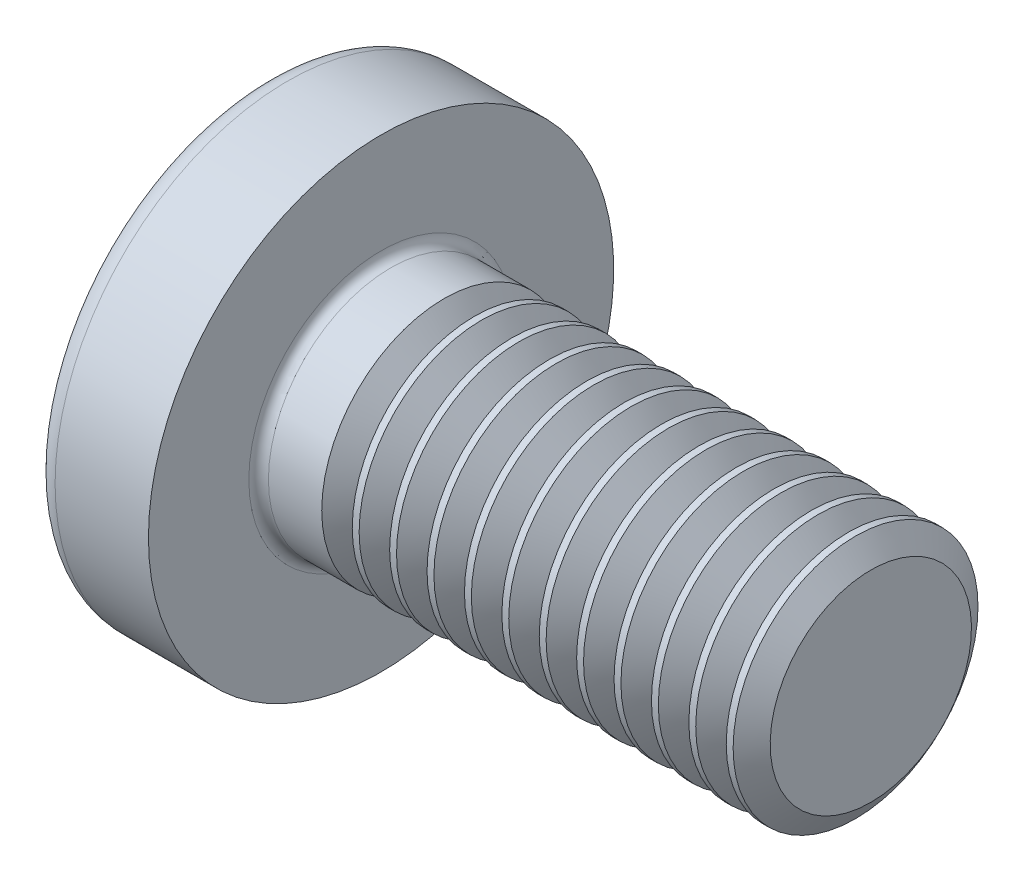
from build123d import *

# Parameters (mm, degrees)
FILLET1_R       = 0.2
RECPAT_COUNT    = 2
RECPAT_ANGLE    = 90
THDSCHPAT_COUNT = 12
THDSCHPAT_PITCH = 0.763636364


with BuildPart() as part:
    # BodySke → Base-Revolve (revolve)
    with BuildSketch(Plane.XY, mode=Mode.PRIVATE) as base_revolve_sk:
        with BuildLine():
            Line((3.7, 2.5), (3.7, 4.75))
            Line((3.7, 4.75), (1.79415598, 4.75))
            ThreePointArc((1.79415598, 4.75), (1.58538712, 4.698642149), (1.424271237, 4.556291391))
            ThreePointArc((1.424271237, 4.556291391), (0.364365445, 2.386856709), (0, 0))
            Line((0, 0), (13.7, 0))
            Line((13.7, 0), (13.7, 2.5))
            Line((13.7, 2.5), (3.7, 2.5))
        make_face()
    revolve(base_revolve_sk.sketch.rotate(Axis((1.79415598, 0, 0), (1, 0, 0)), 90), axis=Axis((1.79415598, 0, 0), (1, 0, 0)))

    # Fillet1
    fillet1_edges = [part.edges().sort_by_distance(p)[0] for p in [
        (3.7, 0, -2.5),
    ]]
    fillet(fillet1_edges, radius=FILLET1_R)

    # Sketch3 → Recess section 0
    with BuildSketch(Plane(origin=(0, 0, 0), x_dir=(0, 0, -1), z_dir=(1, 0, 0))):
        with BuildLine():
            Line((0.515, -2.35), (-0.515, -2.35))
            Line((-0.515, -2.35), (-0.515, 2.35))
            Line((-0.515, 2.35), (0.515, 2.35))
            Line((0.515, 2.35), (0.515, -2.35))
        make_face()
    # Sketch4 → Recess section 1
    with BuildSketch(Plane(origin=(2.74, 0, 0), x_dir=(0, 0, -1), z_dir=(1, 0, 0))):
        with BuildLine():
            Line((0.515, -0.983886622), (-0.515, -0.983886622))
            Line((-0.515, -0.983886622), (-0.515, 0.983886622))
            Line((-0.515, 0.983886622), (0.515, 0.983886622))
            Line((0.515, 0.983886622), (0.515, -0.983886622))
        make_face()
    recess = loft(mode=Mode.SUBTRACT)

    # RecPat: Recess ×2 about axis
    recpat_axis = Axis((0, 0, 0), (1, 0, 0))
    for i in range(1, RECPAT_COUNT):
        add(recess.rotate(recpat_axis, i * RECPAT_ANGLE / (RECPAT_COUNT - 1)), mode=Mode.SUBTRACT)

    # RecCorSke → RecessCore (revolve, cut)
    with BuildSketch(Plane.XY, mode=Mode.PRIVATE) as recesscore_sk:
        Polygon((0, 0), (0, 1.042599465), (2.74, 0.851), (3.016506661, 0), align=None)
    revolve(recesscore_sk.sketch.rotate(Axis((-3.175, 0, 0), (1, 0, 0)), 13.238159177), axis=Axis((-3.175, 0, 0), (1, 0, 0)), mode=Mode.SUBTRACT)

    # ThdSchSke → ThreadSchematic (revolve, cut)
    with BuildSketch(Plane.XY, mode=Mode.PRIVATE) as threadschematic_sk:
        Polygon((5.3, -2.055), (4.988407645, -2.5), (4.988407645, -3.125), (5.611592355, -3.125), (5.611592355, -2.5), align=None)
    threadschematic = revolve(threadschematic_sk.sketch.rotate(Axis((-3.175, 0, 0), (1, 0, 0)), 270), axis=Axis((-3.175, 0, 0), (1, 0, 0)), mode=Mode.SUBTRACT)

    # ThdSchPat: ThreadSchematic ×12
    with Locations(*[(i * THDSCHPAT_PITCH, 0, 0) for i in range(1, THDSCHPAT_COUNT)]):
        add(threadschematic, mode=Mode.SUBTRACT)


solid = part.part
